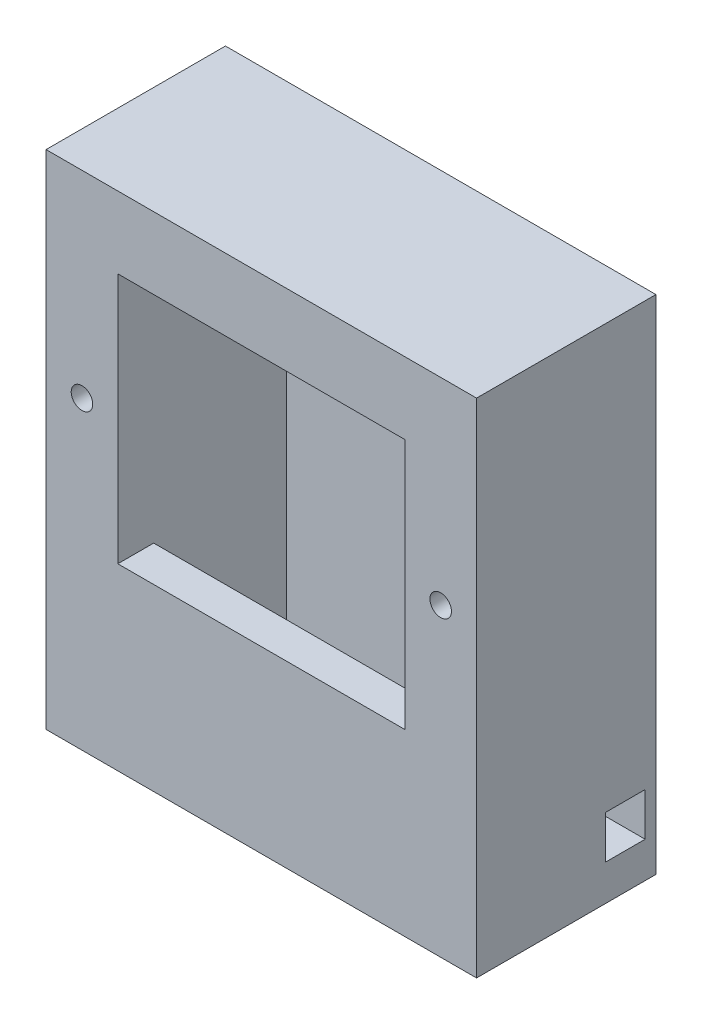
from build123d import *

# Parameters (mm, degrees)
SKETCH2_W           = 120
SKETCH2_H           = 140
BOSS_EXTRUDE1_DEPTH = 50
SKETCH3_R           = 3
SKETCH3_W           = 80
SKETCH3_H           = 70
CUT_EXTRUDE1_DEPTH  = 47
CUT_EXTRUDE3_START  = -10
SKETCH4_W           = 80
SKETCH4_H           = 40
CUT_EXTRUDE3_DEPTH  = 37
SKETCH5_W           = 11
SKETCH5_H           = 12
CUT_EXTRUDE4_DEPTH  = 20


with BuildPart() as part:
    # Sketch2 → Boss-Extrude1 (new body)
    with BuildSketch(Plane.XY):
        with Locations((-60, -70)):
            Rectangle(SKETCH2_W, SKETCH2_H)
    extrude(amount=BOSS_EXTRUDE1_DEPTH)

    # Sketch3 → Cut-Extrude1 (cut)
    with BuildSketch(Plane.XY.offset(50)):
        with Locations((-110, -55)):
            Circle(SKETCH3_R)
        with Locations((-10, -55)):
            Circle(SKETCH3_R)
        with Locations((-60, -55)):
            Rectangle(SKETCH3_W, SKETCH3_H)
    extrude(amount=-CUT_EXTRUDE1_DEPTH, mode=Mode.SUBTRACT)

    # Sketch4 → Cut-Extrude3 (cut)
    with BuildSketch(Plane.XY.offset(50).offset(CUT_EXTRUDE3_START)):
        with Locations((-60, -110)):
            Rectangle(SKETCH4_W, SKETCH4_H)
    extrude(amount=-CUT_EXTRUDE3_DEPTH, mode=Mode.SUBTRACT)

    # Sketch5 → Cut-Extrude4 (cut)
    with BuildSketch(Plane(origin=(0, 0, 0), x_dir=(0, 0, -1), z_dir=(1, 0, 0))):
        with Locations((-8.5, -124)):
            Rectangle(SKETCH5_W, SKETCH5_H)
    extrude(amount=-CUT_EXTRUDE4_DEPTH, mode=Mode.SUBTRACT)


solid = part.part
